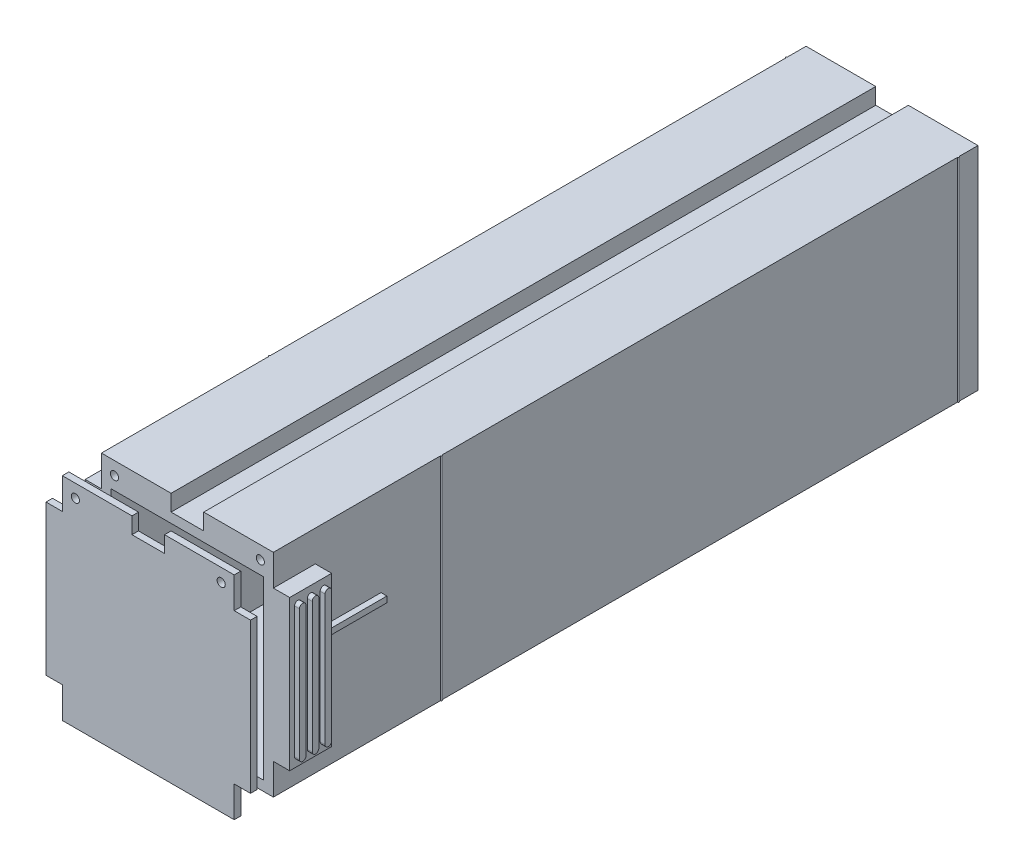
from build123d import *

# Parameters (mm, degrees)
SKETCH_1_W          = 52.7
SKETCH_1_H          = 65
EXTRUDE_1_DEPTH     = 216
SKETCH_2_W          = 10
SKETCH_2_H          = 5
CUT_EXTRUDE_1_DEPTH = 232.642591075
SKETCH_3_W          = 46.7
SKETCH_3_H          = 54
CUT_EXTRUDE_2_DEPTH = 211
SKETCH_6_R          = 1.75
SKETCH_6_W          = 16
SKETCH_6_H          = 16
CUT_EXTRUDE_3_DEPTH = 5
SKETCH_7_W          = 1.8
SKETCH_7_H          = 1.8
EXTRUDE_2_DEPTH     = 33
SKETCH_9_W          = 12.85
SKETCH_9_H          = 46
EXTRUDE_3_DEPTH     = 5
SKETCH_10_W         = 12.85
SKETCH_10_H         = 46
EXTRUDE_4_DEPTH     = 5
EXTRUDE_5_DEPTH     = 1.5
EXTRUDE_START       = 1.5
EXTRUDE_6_DEPTH     = 1.5
EXTRUDE_7_DEPTH     = 2
SKETCH_15_R         = 1.25
CUT_EXTRUDE_4_DEPTH = 20
SKETCH_18_R         = 0.24
EXTRUDE_8_DEPTH     = 65


with BuildPart() as part:
    # 草图1 → 凸台-拉伸1 (new body)
    with BuildSketch(Plane.XY):
        with Locations((26.35, 32.5)):
            Rectangle(SKETCH_1_W, SKETCH_1_H)
    extrude(amount=EXTRUDE_1_DEPTH)

    # 草图2 → 切除-拉伸1 (cut, through all)
    with BuildSketch(Plane.XY.offset(216)):
        with Locations((26.35, 62.5)):
            Rectangle(SKETCH_2_W, SKETCH_2_H)
    extrude(amount=-CUT_EXTRUDE_1_DEPTH, mode=Mode.SUBTRACT)

    # 草图3 → 切除-拉伸2 (cut)
    with BuildSketch(Plane.XY.offset(216)):
        with Locations((26.35, 30)):
            Rectangle(SKETCH_3_W, SKETCH_3_H)
    extrude(amount=-CUT_EXTRUDE_2_DEPTH, mode=Mode.SUBTRACT)

    # 草图6 → 切除-拉伸3 (cut)
    with BuildSketch(Plane(origin=(0, 0, 0), x_dir=(-1, 0, 0), z_dir=(0, 0, -1))):
        with Locations((-13.6, 14.2)):
            Circle(SKETCH_6_R)
        with Locations((-39.1, 14.2)):
            Circle(SKETCH_6_R)
        with Locations((-26.35, 14.2)):
            Rectangle(SKETCH_6_W, SKETCH_6_H)
    extrude(amount=-CUT_EXTRUDE_3_DEPTH, mode=Mode.SUBTRACT)

    # 草图7 → 凸台-拉伸2 (add)
    with BuildSketch(Plane.XY.offset(216)):
        with Locations((53.6, 36.9)):
            Rectangle(SKETCH_7_W, SKETCH_7_H)
    extrude(amount=-EXTRUDE_2_DEPTH)

    # 草图9 → 凸台-拉伸3 (add)
    with BuildSketch(Plane.ZY):
        with Locations((209.575, 32.5)):
            Rectangle(SKETCH_9_W, SKETCH_9_H)
    extrude(amount=EXTRUDE_3_DEPTH)

    # 草图10 → 凸台-拉伸4 (add)
    with BuildSketch(Plane(origin=(52.7, 0, 0), x_dir=(0, 0, -1), z_dir=(1, 0, 0))):
        with Locations((-209.575, 32.5)):
            Rectangle(SKETCH_10_W, SKETCH_10_H)
    extrude(amount=EXTRUDE_4_DEPTH)

    # 草图11 → 凸台-拉伸5 (add)
    with BuildSketch(Plane(origin=(57.7, 0, 0), x_dir=(0, 0, -1), z_dir=(1, 0, 0))):
        with BuildLine():
            Line((-214.5, 12.5), (-214.5, 52.5))
            ThreePointArc((-214.5, 52.5), (-213.5, 53.5), (-212.5, 52.5))
            Line((-212.5, 52.5), (-212.5, 12.5))
            ThreePointArc((-212.5, 12.5), (-213.5, 11.5), (-214.5, 12.5))
        make_face()
        with BuildLine():
            Line((-210.575, 12.5), (-210.575, 52.5))
            ThreePointArc((-210.575, 52.5), (-209.575, 53.5), (-208.575, 52.5))
            Line((-208.575, 52.5), (-208.575, 12.5))
            ThreePointArc((-208.575, 12.5), (-209.575, 11.5), (-210.575, 12.5))
        make_face()
        with BuildLine():
            Line((-206.65, 12.5), (-206.65, 52.5))
            ThreePointArc((-206.65, 52.5), (-205.65, 53.5), (-204.65, 52.5))
            Line((-204.65, 52.5), (-204.65, 12.5))
            ThreePointArc((-204.65, 12.5), (-205.65, 11.5), (-206.65, 12.5))
        make_face()
    extrude(amount=EXTRUDE_5_DEPTH)

    # 草图12 → 凸台-拉伸6 (add)
    with BuildSketch(Plane.ZY.offset(5).offset(EXTRUDE_START)):
        with BuildLine():
            Line((214.5, 12.5), (214.5, 52.5))
            ThreePointArc((214.5, 52.5), (213.5, 53.5), (212.5, 52.5))
            Line((212.5, 52.5), (212.5, 12.5))
            ThreePointArc((212.5, 12.5), (213.5, 11.5), (214.5, 12.5))
        make_face()
        with BuildLine():
            Line((206.65, 12.5), (206.65, 52.5))
            ThreePointArc((206.65, 52.5), (205.65, 53.5), (204.65, 52.5))
            Line((204.65, 52.5), (204.65, 12.5))
            ThreePointArc((204.65, 12.5), (205.65, 11.5), (206.65, 12.5))
        make_face()
        with BuildLine():
            Line((210.575, 12.5), (210.575, 52.5))
            ThreePointArc((210.575, 52.5), (209.575, 53.5), (208.575, 52.5))
            Line((208.575, 52.5), (208.575, 12.5))
            ThreePointArc((208.575, 12.5), (209.575, 11.5), (210.575, 12.5))
        make_face()
    extrude(amount=-EXTRUDE_6_DEPTH)


with BuildPart() as body_2:
    # 草图14 → 凸台-拉伸7 (new body)
    with BuildSketch(Plane.XY.offset(226)):
        Polygon((57.7, 55.5), (52.7, 55.5), (52.7, 65), (31.35, 65), (31.35, 60), (21.35, 60), (21.35, 65), (0, 65), (0, 55.5), (-5, 55.5), (-5, 9.5), (0, 9.5), (0, 0), (52.7, 0), (52.7, 9.5), (57.7, 9.5), align=None)
    extrude(amount=EXTRUDE_7_DEPTH)


with BuildPart() as cut_extrude_4_tool:
    # 草图15 → 切除-拉伸4 (new body)
    with BuildSketch(Plane.XY.offset(228)):
        with Locations((4, 61)):
            Circle(SKETCH_15_R)
        with Locations((48.7, 61)):
            Circle(SKETCH_15_R)
    extrude(amount=-CUT_EXTRUDE_4_DEPTH)


with BuildPart() as part_1:
    add(part.part)

    # 切除-拉伸4: cut by cut_extrude_4_tool
    add(cut_extrude_4_tool.part, mode=Mode.SUBTRACT)

    # 草图18 → 凸台-拉伸8 (add)
    with BuildSketch(Plane.XZ):
        with Locations((0, 6)):
            Circle(SKETCH_18_R)
        with Locations((52.7, 6)):
            Circle(SKETCH_18_R)
        with Locations((0, 164.5)):
            Circle(SKETCH_18_R)
        with Locations((52.7, 164.5)):
            Circle(SKETCH_18_R)
    extrude(amount=-EXTRUDE_8_DEPTH)


with BuildPart() as body_2_1:
    add(body_2.part)

    # 切除-拉伸4: cut by cut_extrude_4_tool
    add(cut_extrude_4_tool.part, mode=Mode.SUBTRACT)


solid = Compound([part_1.part, body_2_1.part])
